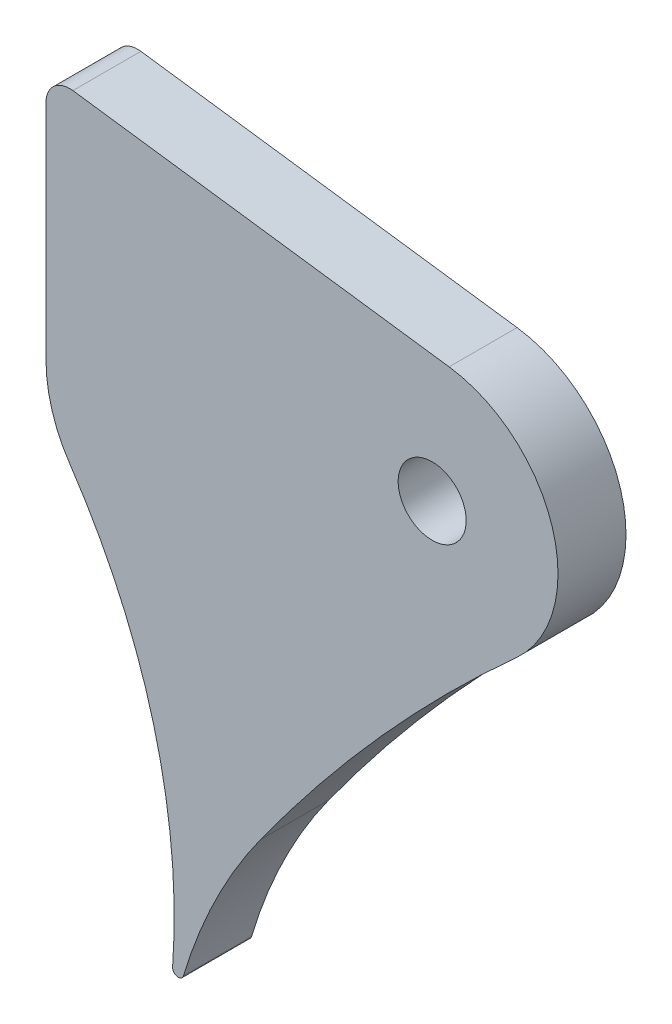
from build123d import *

# Parameters (mm, degrees)
BOSS_EXTRUDE1_DEPTH = 1
SKETCH2_R           = 0.5
CUT_EXTRUDE1_DEPTH  = 1


with BuildPart() as part:
    # Sketch1 → Boss-Extrude1 (new body)
    with BuildSketch(Plane.XY):
        with BuildLine():
            Line((0.566665575, 10.621911003), (4.836785257, 10.041508622))
            ThreePointArc((4.836785257, 10.041508622), (6.355848418, 8.75345876), (5.826769046, 6.833380545))
            ThreePointArc((5.826769046, 6.833380545), (3.832723198, 4.833381254), (2.062195705, 2.633052095))
            ThreePointArc((2.062195705, 2.633052095), (1.400201905, 1.530760177), (0.930843559, 0.333686241))
            ThreePointArc((0.930843559, 0.333686241), (0.837560316, 0.276531253), (0.770614998, 0.363057438))
            ThreePointArc((0.770614998, 0.363057438), (0.491345948, 3.315426366), (-0.739361897, 6.013542688))
            ThreePointArc((-0.739361897, 6.013542688), (-1.001481879, 6.56165987), (-1.091488982, 7.162524291))
            Line((-1.091488982, 7.162524291), (-1.091488982, 10.448413118))
            ThreePointArc((-1.091488982, 10.448413118), (-0.97227959, 10.710781676), (-0.696246031, 10.793568229))
            Line((-0.696246031, 10.793568229), (0.566665575, 10.621911003))
        make_face()
    extrude(amount=BOSS_EXTRUDE1_DEPTH)

    # Sketch2 → Cut-Extrude1 (cut)
    with BuildSketch(Plane.XY.offset(1)):
        with Locations((4.58754209, 8.207783975)):
            Circle(SKETCH2_R)
    extrude(amount=-CUT_EXTRUDE1_DEPTH, mode=Mode.SUBTRACT)


solid = part.part
